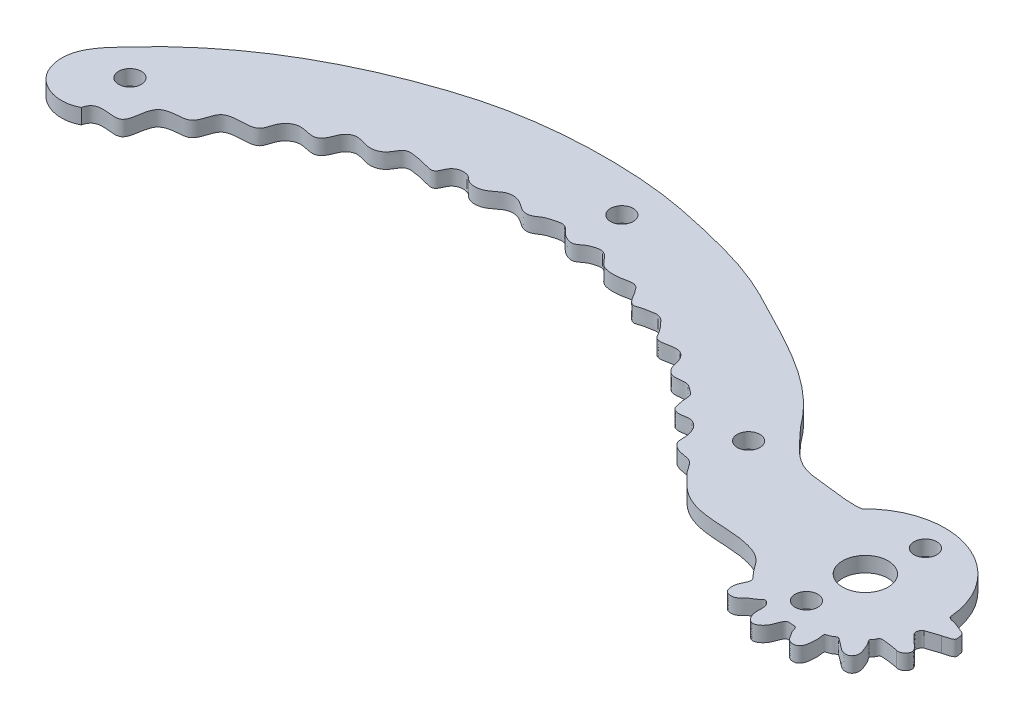
from build123d import *

# Parameters (mm, degrees)
SKETCH_1_R      = 1.5
SKETCH_1_R_2    = 2.999147906
EXTRUDE_1_DEPTH = 2


with BuildPart() as part:
    # 草图1 → 凸台-拉伸1 (new body)
    with BuildSketch(Plane(origin=(0, 0, 0), x_dir=(1, 0, 0), z_dir=(0, 1, 0))):
        with BuildLine():
            Line((10.455900132, -2.638973747), (12.171271629, -2.064133862))
            add(Edge.make_bspline(
                [(12.171271629, -2.064133862), (12.372801336, -2.016849509), (12.825308426, -1.886765514), (13.655646423, -1.650968866), (13.468205244, -1.012405016), (13.430984307, -0.458279246), (12.545387681, -0.119217039), (11.779897031, 0.278212169), (10.694572455, 0.405901224), (10.596852254, 0.717116861), (10.591145679, 0.742905006)],
                knots=[0.147270796, 0.147270796, 0.147270796, 0.147270796, 0.159535905, 0.175521474, 0.184329942, 0.192983843, 0.205694655, 0.23111628, 0.25069733, 0.252370277, 0.252370277, 0.252370277, 0.252370277], degree=3))
            ThreePointArc((10.591145679, 0.742905006), (10.58214851, 0.774137404), (10.577384491, 0.806288855))
            ThreePointArc((10.577384491, 0.806288855), (3.614144189, 9.861314902), (-7.494670512, 7.201531423))
            add(Edge.make_bspline(
                [(-7.494670512, 7.201531423), (-7.921204354, 7.096828525), (-9.610724853, 7.060896313), (-12.379589553, 7.535170352), (-17.199043256, 7.740736585), (-19.520676432, 11.070256626), (-20.929113858, 12.463431504)],
                knots=[0.711171768, 0.711171768, 0.711171768, 0.711171768, 0.736619646, 0.803221292, 0.875531472, 1, 1, 1, 1], degree=3))
            add(Edge.make_bspline(
                [(-20.929113858, 12.463431504), (-24.683802464, 17.675141592), (-32.004673593, 21.371454641), (-42.002425646, 26.647195483), (-48.919229149, 28.453651001), (-55.6844568, 29.901526591), (-61.832150207, 30.441888047), (-69.412590339, 30.409611152), (-76.951540257, 29.357483213), (-83.753087754, 27.263495508), (-91.264095604, 24.369039298), (-100.368425273, 19.415682331), (-107.523974883, 12.987745245), (-111.742318353, 7.976480662), (-111.801704662, 4.772014871), (-110.135134016, 1.344481749), (-106.731437881, 0.485755819), (-104.782283871, 1.553170246)],
                knots=[0, 0, 0, 0, 0.162308773, 0.214040795, 0.297345888, 0.349154488, 0.396314503, 0.459530434, 0.548645129, 0.595484357, 0.646703325, 0.76081959, 0.864658636, 0.902713076, 0.926128156, 0.944546812, 1, 1, 1, 1], degree=3))
            add(Edge.make_bspline(
                [(-104.782283871, 1.553170246), (-104.317213885, 3.698063505), (-99.653592287, 0.93744074), (-100.508564997, 6.534782019), (-97.820980569, 7.002801478), (-95.441650596, 7.063771202), (-95.388939244, 10.578918062), (-92.564857478, 10.360280099), (-90.355292652, 10.699675281), (-90.19953425, 12.686904732), (-88.654208185, 14.01532461), (-87.123998758, 13.603061807), (-85.897471237, 13.423711667), (-84.915188226, 14.404349979), (-84.751693942, 15.710995856), (-83.247934935, 16.628183532), (-81.974226628, 15.952772746), (-80.549934115, 15.930007851), (-79.299712184, 16.584727053), (-78.812550884, 18.198870142), (-77.070473106, 18.025913496), (-75.881285245, 17.764661215), (-74.05648752, 17.182258931), (-73.674852856, 19.489026995), (-71.842965839, 19.568901669), (-71.214423758, 19.017281041)],
                knots=[0, 0, 0, 0, 0.100331873, 0.186040252, 0.234954161, 0.270300487, 0.337741822, 0.40191981, 0.438279808, 0.476829941, 0.523229195, 0.559516768, 0.58417291, 0.604077361, 0.648703103, 0.670042471, 0.715950186, 0.738312734, 0.768610762, 0.808997733, 0.834826144, 0.87587524, 0.906400305, 0.9417144, 1, 1, 1, 1], degree=3))
            add(Edge.make_bspline(
                [(-71.214423758, 19.017281041), (-70.593237707, 18.290867091), (-68.662595961, 18.281231373), (-67.389659817, 19.86647669), (-65.862919225, 19.998276565), (-64.816379885, 19.498364229), (-63.913060508, 18.730302108), (-62.747743822, 18.724460661), (-61.899203578, 19.479370666), (-60.77049506, 19.789647993), (-59.411987986, 20.181438312), (-58.659675994, 19.072906138), (-57.816852401, 18.545059005), (-56.747970165, 18.237006833), (-55.972518951, 19.056359392), (-55.032067728, 19.408404584), (-53.963416871, 19.647745053), (-53.040833364, 18.793502182), (-52.299033918, 17.68675176), (-50.814941444, 17.495732348), (-49.211661347, 17.644166668), (-47.946904431, 18.098835543), (-47.458989145, 17.193338777)],
                knots=[0, 0, 0, 0, 0.101433113, 0.182304189, 0.213922123, 0.268056796, 0.309965909, 0.34593792, 0.389140378, 0.432998877, 0.482664358, 0.529097115, 0.56671955, 0.598853252, 0.644172777, 0.680167064, 0.715860802, 0.759457234, 0.81099574, 0.863337515, 0.916048189, 1, 1, 1, 1], degree=3))
            add(Edge.make_bspline(
                [(-47.458989145, 17.193338777), (-47.106617881, 16.970676575), (-46.398376817, 14.887749735), (-45.017466004, 15.614255531), (-44.135943026, 15.702872531), (-43.257914938, 15.980736821), (-42.435740175, 15.604606532), (-41.764736846, 14.858206903), (-41.089283235, 14.083019006), (-40.465697678, 12.75745404), (-38.914676722, 13.176340001), (-37.455111702, 13.335487104), (-36.249317567, 11.937736792), (-36.418173886, 10.697071111), (-35.715379656, 10.170130285)],
                knots=[0, 0, 0, 0, 0.161236225, 0.212348344, 0.265446348, 0.336192936, 0.378687986, 0.430636784, 0.526782428, 0.58317029, 0.682556587, 0.781270878, 0.853713789, 1, 1, 1, 1], degree=3))
            add(Edge.make_bspline(
                [(-35.715379656, 10.170130285), (-34.995485732, 9.508975752), (-33.571351409, 10.395822533), (-32.524721224, 9.3967436), (-31.761865661, 8.99160927), (-31.748757803, 7.937546336), (-31.590922485, 7.09365622), (-31.367326511, 6.158221504), (-30.365257289, 5.834101317), (-29.411967855, 6.245107419), (-28.289648396, 5.876671941), (-27.631126157, 4.96624602), (-27.340818237, 3.836386076), (-27.458818177, 2.718325895), (-26.780478903, 1.960858649), (-25.755027883, 1.557202717), (-24.200096577, 1.514160443), (-23.560504112, 0.120532563), (-22.373880468, -1.050035213), (-21.195928961, -2.343677766), (-18.779324975, -3.640765459), (-15.279736489, -4.087082836), (-11.695617004, -4.069524572), (-8.530087756, -5.379322629), (-7.706339614, -7.087502761), (-6.419461089, -8.253039633), (-7.063345775, -9.248451648), (-7.328537729, -10.188740868), (-7.123956988, -11.40694228), (-5.693114285, -11.474791529), (-4.996552806, -10.482365969), (-4.166586057, -10.17735604), (-3.510183133, -9.417156968), (-2.748339001, -10.115302225), (-2.778051716, -11.115171399), (-2.790663017, -12.252115576), (-1.791700902, -13.411872645), (-0.555155149, -12.574584667), (-0.164840274, -11.619634708), (0.248956515, -10.458355696), (1.013778617, -10.64791748), (1.671240476, -10.611556264), (1.770225057, -11.351561183), (2.20863686, -11.923222274), (2.613049812, -12.774661375), (3.857619795, -12.923210432), (4.321186796, -11.995064195), (4.379961492, -11.179159358), (4.443984819, -10.446750928), (4.167461344, -9.524117992), (5.020599505, -9.486778678), (5.48520172, -8.89459613), (6.025517317, -9.383886831), (6.693461042, -9.823133193), (7.451374313, -10.557825838), (8.463811096, -10.469905707), (8.880435843, -9.832120245), (8.785591695, -9.075066034), (8.47420716, -8.380009989), (8.233790596, -7.786585964), (7.750756732, -7.260571853), (8.236984345, -6.925066694), (8.340734589, -6.349341541), (9.530768193, -6.466595098), (10.177473459, -6.520696004), (10.874329717, -6.677799116)],
                knots=[0, 0, 0, 0, 0.036097754, 0.047992692, 0.058181774, 0.069734768, 0.087708592, 0.096698401, 0.107023851, 0.126400839, 0.138602891, 0.153227265, 0.171393147, 0.187122158, 0.197485969, 0.211171774, 0.233173167, 0.256561051, 0.268556148, 0.303731538, 0.328871743, 0.381864229, 0.448811497, 0.480255529, 0.51707058, 0.528247924, 0.545423341, 0.55711902, 0.571395296, 0.589105263, 0.601142621, 0.619943519, 0.626676905, 0.637700506, 0.65076311, 0.668889993, 0.685366138, 0.701511805, 0.71875472, 0.73297241, 0.74288652, 0.748199785, 0.757993847, 0.767232555, 0.779863379, 0.795449066, 0.807138678, 0.81859081, 0.829540719, 0.840490628, 0.847986573, 0.859378383, 0.863943502, 0.875154629, 0.894934332, 0.904612351, 0.913268634, 0.923572897, 0.93535553, 0.944471884, 0.95284684, 0.957200242, 0.965914569, 0.973104959, 1, 1, 1, 1], degree=3))
            add(Edge.make_bspline(
                [(10.874329717, -6.677799116), (11.385312136, -6.901918517), (12.481269037, -6.001683683), (11.420957321, -4.80613632), (10.65876664, -4.233847807), (9.900111498, -3.420231783), (10.173727402, -2.800770762), (10.429798983, -2.652512614), (10.455900132, -2.638973747)],
                knots=[0, 0, 0, 0, 0.030921729, 0.048081089, 0.078364485, 0.090960366, 0.106141953, 0.107821813, 0.107821813, 0.107821813, 0.107821813], degree=3))
        make_face()
        with Locations(Location((-104.962063857, 8.128886292, 0), (0, 0, 270))):
            Circle(SKETCH_1_R, mode=Mode.SUBTRACT)
        with Locations(Location((-56.903151793, 24.88984348, 0), (0, 0, 270))):
            Circle(SKETCH_1_R, mode=Mode.SUBTRACT)
        with Locations(Location((-22.76532669, 7.451477316, 0), (0, 0, 270))):
            Circle(SKETCH_1_R, mode=Mode.SUBTRACT)
        with Locations(Location((-0.711963496, -6.974775877, 0), (0, 0, 270))):
            Circle(SKETCH_1_R, mode=Mode.SUBTRACT)
        with Locations(Location((0.111317499, -0.037180102, 0), (0, 0, 270))):
            Circle(SKETCH_1_R_2, mode=Mode.SUBTRACT)
        with Locations(Location((1.135228957, 6.858762974, 0), (0, 0, 270))):
            Circle(SKETCH_1_R, mode=Mode.SUBTRACT)
    extrude(amount=EXTRUDE_1_DEPTH)


solid = part.part
